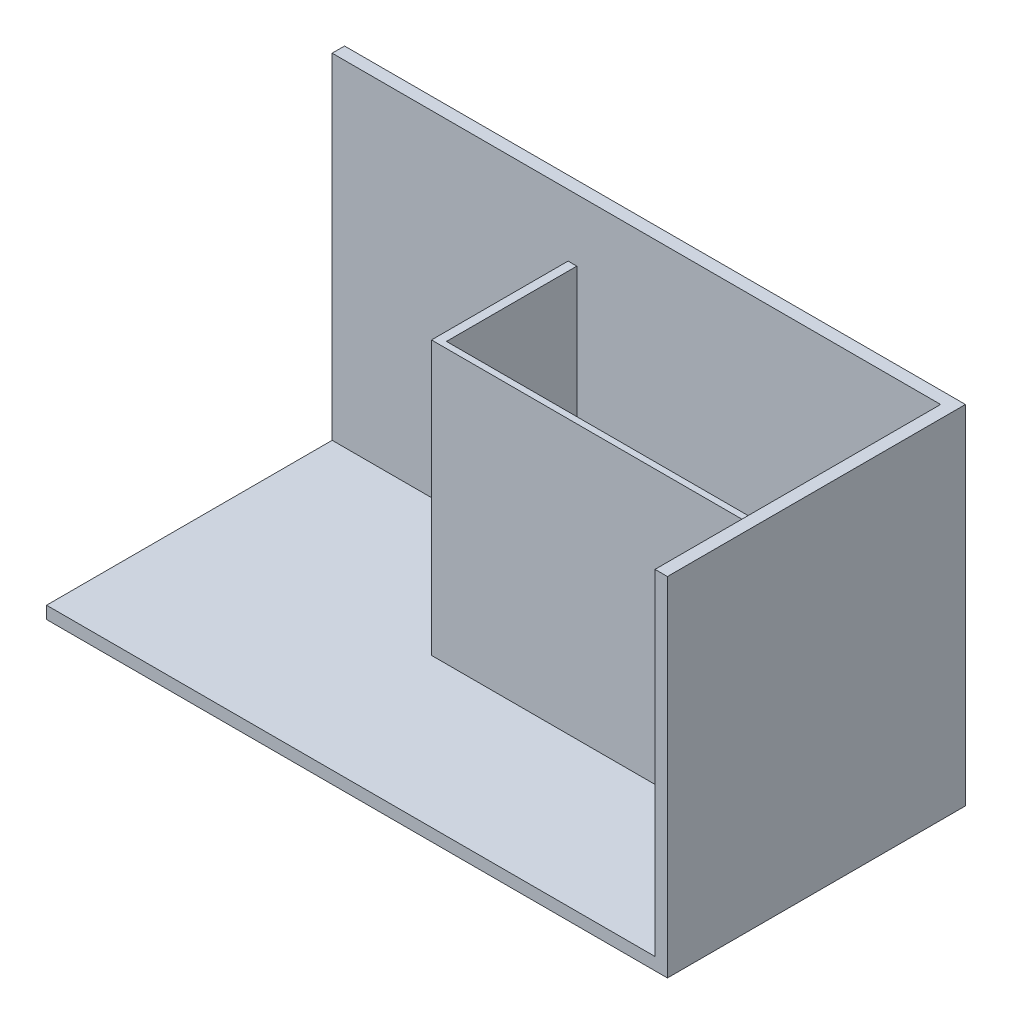
from build123d import *

# Parameters (mm, degrees)
ESQUISSE1_W        = 5000
ESQUISSE1_H        = 2400
BOSS_EXTRU_1_DEPTH = 100
ESQUISSE2_W        = 5000
ESQUISSE2_H        = 2700
BOSS_EXTRU_2_DEPTH = 100
ESQUISSE3_W        = 2400
ESQUISSE3_H        = 2700
BOSS_EXTRU_3_DEPTH = 100
ESQUISSE22_W       = 70.403025722
ESQUISSE22_H       = 1100
BOSS_EXTRU_8_DEPTH = 2200
ESQUISSE23_W       = 3000
ESQUISSE23_H       = 50
BOSS_EXTRU_9_DEPTH = 2200


with BuildPart() as part:
    # Esquisse1 → Boss.-Extru.1 (new body)
    with BuildSketch(Plane(origin=(0, 0, 0), x_dir=(1, 0, 0), z_dir=(0, 1, 0))):
        with Locations((2433.645902302, 1144.428443178)):
            Rectangle(ESQUISSE1_W, ESQUISSE1_H)
    extrude(amount=-BOSS_EXTRU_1_DEPTH)

    # Esquisse2 → Boss.-Extru.2 (add)
    with BuildSketch(Plane(origin=(0, 0, -2344.428443178), x_dir=(-1, 0, 0), z_dir=(0, 0, -1))):
        with Locations((-2433.645902302, 1350)):
            Rectangle(ESQUISSE2_W, ESQUISSE2_H)
    extrude(amount=-BOSS_EXTRU_2_DEPTH)

    # Esquisse3 → Boss.-Extru.3 (add)
    with BuildSketch(Plane(origin=(4933.645902302, 0, 0), x_dir=(0, 0, -1), z_dir=(1, 0, 0))):
        with Locations((1144.428443178, 1350)):
            Rectangle(ESQUISSE3_W, ESQUISSE3_H)
    extrude(amount=-BOSS_EXTRU_3_DEPTH)

    # Esquisse22 → Boss.-Extru.8 (add)
    with BuildSketch(Plane(origin=(0, 0, 0), x_dir=(1, 0, 0), z_dir=(0, 1, 0))):
        with Locations((1868.847415163, 1694.428443178)):
            Rectangle(ESQUISSE22_W, ESQUISSE22_H)
    extrude(amount=BOSS_EXTRU_8_DEPTH)

    # Esquisse23 → Boss.-Extru.9 (add)
    with BuildSketch(Plane(origin=(0, 0, 0), x_dir=(1, 0, 0), z_dir=(0, 1, 0))):
        with Locations((3333.645902302, 1169.428443178)):
            Rectangle(ESQUISSE23_W, ESQUISSE23_H)
    extrude(amount=BOSS_EXTRU_9_DEPTH)


solid = part.part
